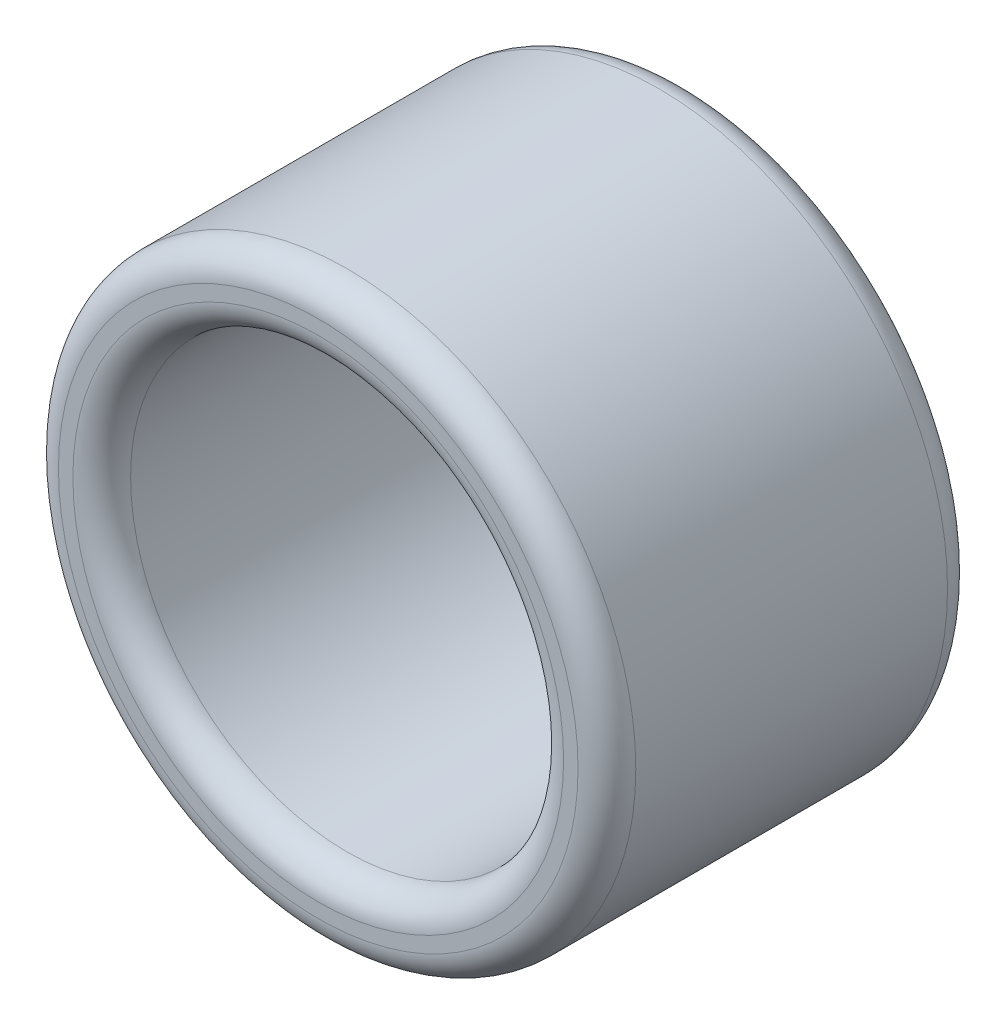
from build123d import *

# Parameters (mm, degrees)
ESQUISSE1_R        = 2
ESQUISSE1_R_2      = 1.5
BOSS_EXTRU_1_DEPTH = 2.56
CONG_1_R           = 0.2


with BuildPart() as part:
    # Esquisse1 → Boss.-Extru.1 (new body)
    with BuildSketch(Plane.XY):
        with Locations(Location((0, 0, 0), (0, 0, 180))):
            Circle(ESQUISSE1_R)
        with Locations(Location((0, 0, 0), (0, 0, 180))):
            Circle(ESQUISSE1_R_2, mode=Mode.SUBTRACT)
    extrude(amount=BOSS_EXTRU_1_DEPTH)

    # Congé1
    cong_1_edges = [part.edges().sort_by_distance(p)[0] for p in [
        (2, 0, 0),
        (2, 0, 2.56),
        (1.5, 0, 0),
        (1.5, 0, 2.56),
    ]]
    fillet(cong_1_edges, radius=CONG_1_R)


solid = part.part
